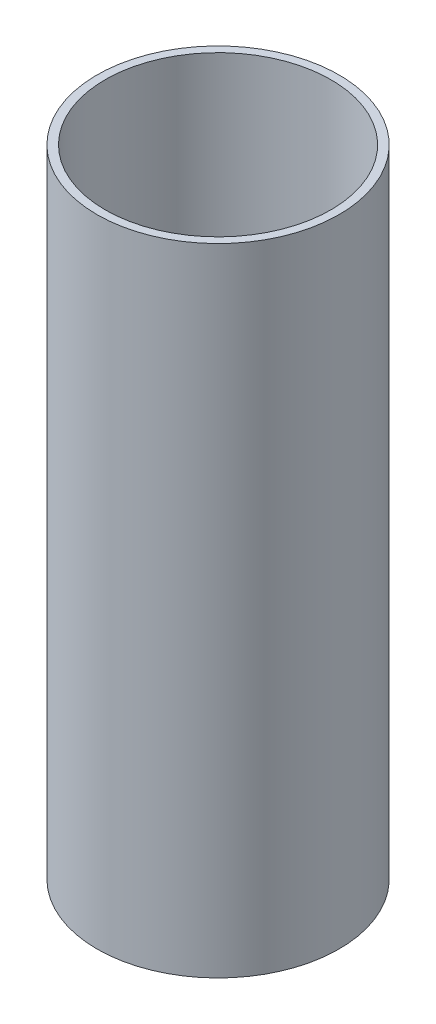
from build123d import *

# Parameters (mm, degrees)
SKETCH1_R           = 37.7
SKETCH1_R_2         = 35.15
BOSS_EXTRUDE1_DEPTH = 198.12


with BuildPart() as part:
    # Sketch1 → Boss-Extrude1 (new body)
    with BuildSketch(Plane(origin=(0, 0, 0), x_dir=(1, 0, 0), z_dir=(0, 1, 0))):
        with Locations(Location((0, 0, 0), (0, 0, 270))):
            Circle(SKETCH1_R)
        with Locations(Location((0, 0, 0), (0, 0, 270))):
            Circle(SKETCH1_R_2, mode=Mode.SUBTRACT)
    extrude(amount=BOSS_EXTRUDE1_DEPTH)


solid = part.part
